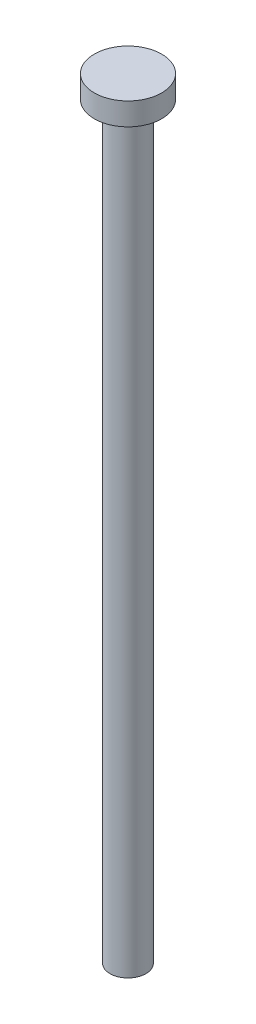
from build123d import *

# Parameters (mm, degrees)
CROQUIS1_R              = 2.4
SALIENTE_EXTRUIR1_DEPTH = 50
CROQUIS2_R              = 4.5
SALIENTE_EXTRUIR2_DEPTH = 3


with BuildPart() as part:
    # Croquis1 → Saliente-Extruir1 (new, symmetric)
    with BuildSketch(Plane(origin=(0, 0, 0), x_dir=(1, 0, 0), z_dir=(0, 1, 0))):
        with Locations(Location((0, 0, 0), (0, 0, 270))):
            Circle(CROQUIS1_R)
    extrude(amount=SALIENTE_EXTRUIR1_DEPTH, both=True)

    # Croquis2 → Saliente-Extruir2 (add)
    with BuildSketch(Plane(origin=(0, 50, 0), x_dir=(1, 0, 0), z_dir=(0, 1, 0))):
        with Locations(Location((0, 0, 0), (0, 0, 270))):
            Circle(CROQUIS2_R)
    extrude(amount=SALIENTE_EXTRUIR2_DEPTH)


solid = part.part
